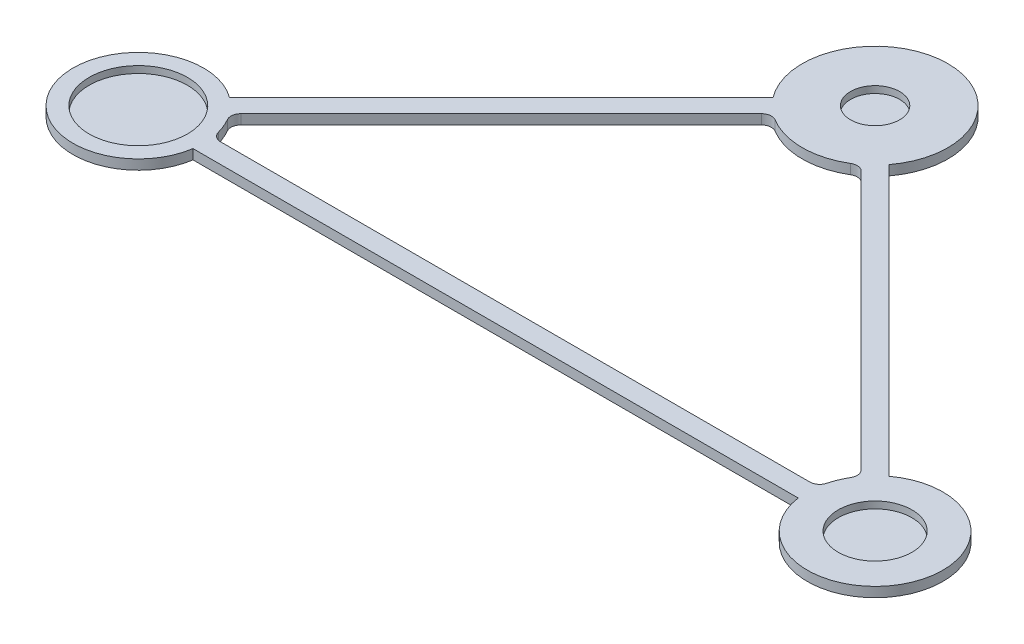
from build123d import *

# Parameters (mm, degrees)
AUFSATZ_LINEAR_AUSTRAGEN1_DEPTH = 2
SKIZZE2_R                       = 5
SKIZZE2_R_2                     = 10
SKIZZE2_R_3                     = 7.5
SCHNITT_LINEAR_AUSTRAGEN1_DEPTH = 1.4
VERRUNDUNG1_R                   = 2


with BuildPart() as part:
    # Skizze1 → Aufsatz-Linear austragen1 (new body)
    with BuildSketch(Plane(origin=(0, 0, 0), x_dir=(1, 0, 0), z_dir=(0, 1, 0))):
        with BuildLine():
            Line((-11.803204492, 66.025222633), (-67.124306483, 10.704120642))
            ThreePointArc((-67.124306483, 10.704120642), (-87.277686291, -5.085584176), (-61.862087415, -2))
            Line((-61.862087415, -2), (61.34027937, -2))
            ThreePointArc((61.34027937, -2), (87.754489642, -5.283082591), (66.755332476, 11.073094649))
            Line((66.755332476, 11.073094649), (11.803204492, 66.025222633))
            ThreePointArc((11.803204492, 66.025222633), (0, 89.827753204), (-11.803204492, 66.025222633))
        make_face()
        with BuildLine():
            Line((-8.974777367, 63.196795508), (-64.295879358, 7.875693517))
            ThreePointArc((-64.295879358, 7.875693517), (-62.722313709, 5.085584176), (-61.862087415, 2))
            Line((-61.862087415, 2), (61.34027937, 2))
            ThreePointArc((61.34027937, 2), (62.245510358, 5.283082591), (63.926905351, 8.244667524))
            Line((63.926905351, 8.244667524), (8.974777367, 63.196795508))
            ThreePointArc((8.974777367, 63.196795508), (0, 60.172246796), (-8.974777367, 63.196795508))
        make_face(mode=Mode.SUBTRACT)
    extrude(amount=AUFSATZ_LINEAR_AUSTRAGEN1_DEPTH)

    # Skizze2 → Schnitt-Linear austragen1 (cut)
    with BuildSketch(Plane(origin=(0, 2, 0), x_dir=(1, 0, 0), z_dir=(0, 1, 0))):
        with Locations(Location((0, 75, 0), (0, 0, 270))):
            Circle(SKIZZE2_R)
        with Locations(Location((-75, 0, 0), (0, 0, 270))):
            Circle(SKIZZE2_R_2)
        with Locations(Location((75, 0, 0), (0, 0, 270))):
            Circle(SKIZZE2_R_3)
    extrude(amount=-SCHNITT_LINEAR_AUSTRAGEN1_DEPTH, mode=Mode.SUBTRACT)

    # Verrundung1
    verrundung1_edges = [part.edges().sort_by_distance(p)[0] for p in [
        (-64.295879358, 1, -7.875693517),
        (-61.862087415, 1, -2),
        (61.34027937, 1, -2),
        (63.926905351, 1, -8.244667524),
        (8.974777367, 1, -63.196795508),
        (-8.974777367, 1, -63.196795508),
    ]]
    fillet(verrundung1_edges, radius=VERRUNDUNG1_R)


solid = part.part
